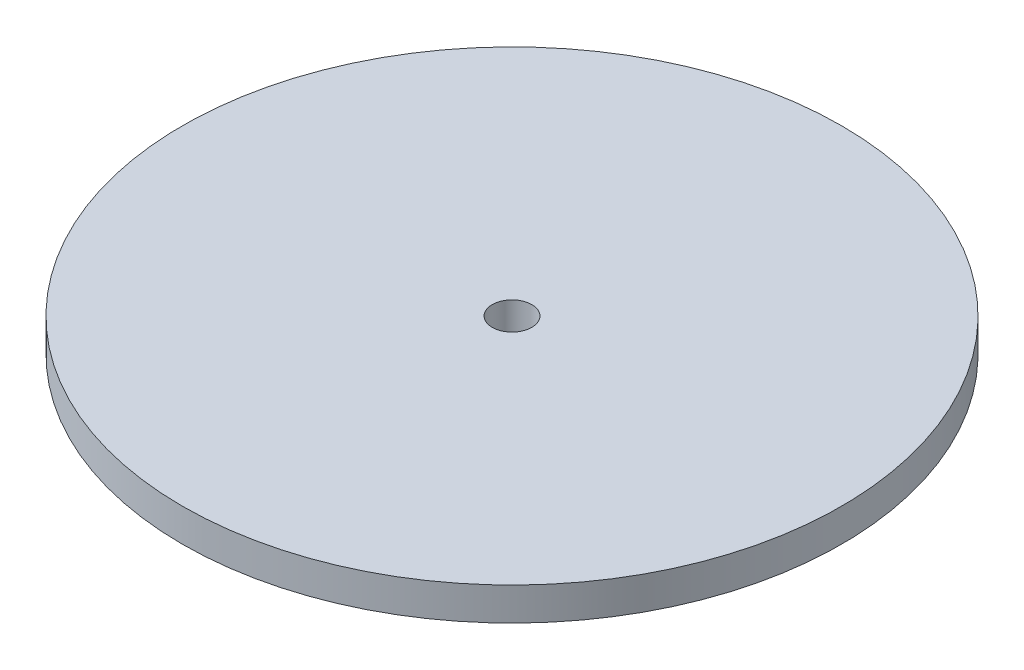
from build123d import *

# Parameters (mm, degrees)
SKETCH1_W          = 470
SKETCH1_H          = 50
CUT_EXTRUDE1_DEPTH = 20


with BuildPart() as part:
    # Sketch1 → Revolve1 (revolve)
    with BuildSketch(Plane(origin=(0, 0, 0), x_dir=(0, 0, -1), z_dir=(1, 0, 0))):
        with Locations((-265, 0)):
            Rectangle(SKETCH1_W, SKETCH1_H)
    revolve(axis=Axis((0, 285.555555556, 0), (0, -1, 0)))

    # Sketch2 → Cut-Extrude1 (cut)
    with BuildSketch(Plane.XZ.offset(25)):
        with BuildLine():
            Line((-180, 446.476151588), (-122.573000413, 307.835110337))
            ThreePointArc((-122.573000413, 307.835110337), (0, 330), (122.573000413, 307.835110337))
            Line((122.573000413, 307.835110337), (180, 446.476151588))
            ThreePointArc((180, 446.476151588), (0, 480), (-180, 446.476151588))
        make_face()
        with BuildLine():
            Line((188.427093812, 442.985535039), (131.000094225, 304.344493789))
            ThreePointArc((131.000094225, 304.344493789), (233.345237792, 233.345237792), (304.344493789, 131.000094225))
            Line((304.344493789, 131.000094225), (442.985535039, 188.427093812))
            ThreePointArc((442.985535039, 188.427093812), (339.41125497, 339.41125497), (188.427093812, 442.985535039))
        make_face()
        with BuildLine():
            Line((446.476151588, 180), (307.835110337, 122.573000413))
            ThreePointArc((307.835110337, 122.573000413), (330, 0), (307.835110337, -122.573000413))
            Line((307.835110337, -122.573000413), (446.476151588, -180))
            ThreePointArc((446.476151588, -180), (480, 0), (446.476151588, 180))
        make_face()
        with BuildLine():
            Line((442.985535039, -188.427093812), (304.344493789, -131.000094225))
            ThreePointArc((304.344493789, -131.000094225), (233.345237792, -233.345237792), (131.000094225, -304.344493789))
            Line((131.000094225, -304.344493789), (188.427093812, -442.985535039))
            ThreePointArc((188.427093812, -442.985535039), (339.41125497, -339.41125497), (442.985535039, -188.427093812))
        make_face()
        with BuildLine():
            Line((180, -446.476151588), (122.573000413, -307.835110337))
            ThreePointArc((122.573000413, -307.835110337), (0, -330), (-122.573000413, -307.835110337))
            Line((-122.573000413, -307.835110337), (-180, -446.476151588))
            ThreePointArc((-180, -446.476151588), (0, -480), (180, -446.476151588))
        make_face()
        with BuildLine():
            Line((-188.427093812, -442.985535039), (-131.000094225, -304.344493789))
            ThreePointArc((-131.000094225, -304.344493789), (-233.345237792, -233.345237792), (-304.344493789, -131.000094225))
            Line((-304.344493789, -131.000094225), (-442.985535039, -188.427093812))
            ThreePointArc((-442.985535039, -188.427093812), (-339.41125497, -339.41125497), (-188.427093812, -442.985535039))
        make_face()
        with BuildLine():
            Line((-446.476151588, -180), (-307.835110337, -122.573000413))
            ThreePointArc((-307.835110337, -122.573000413), (-330, 0), (-307.835110337, 122.573000413))
            Line((-307.835110337, 122.573000413), (-446.476151588, 180))
            ThreePointArc((-446.476151588, 180), (-480, 0), (-446.476151588, -180))
        make_face()
        with BuildLine():
            Line((-442.985535039, 188.427093812), (-304.344493789, 131.000094225))
            ThreePointArc((-304.344493789, 131.000094225), (-233.345237792, 233.345237792), (-131.000094225, 304.344493789))
            Line((-131.000094225, 304.344493789), (-188.427093812, 442.985535039))
            ThreePointArc((-188.427093812, 442.985535039), (-339.41125497, 339.41125497), (-442.985535039, 188.427093812))
        make_face()
    extrude(amount=-CUT_EXTRUDE1_DEPTH, mode=Mode.SUBTRACT)


solid = part.part
